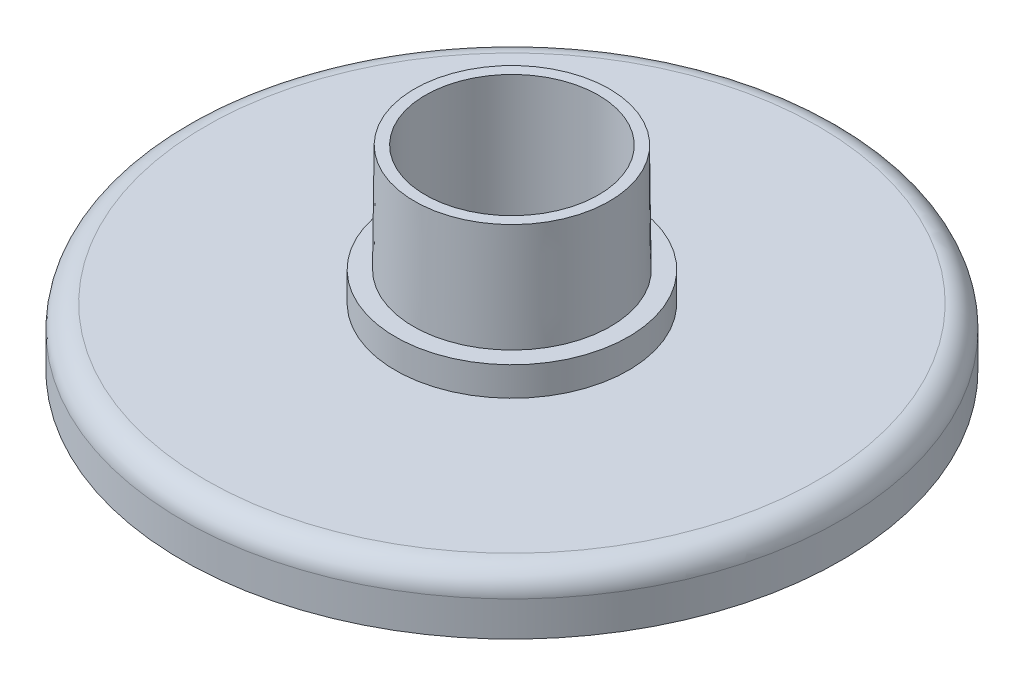
from build123d import *


with BuildPart() as part:
    # Sketch1 → Revolve1 (revolve)
    with BuildSketch(Plane(origin=(0, 0, 0), x_dir=(0, 0, -1), z_dir=(1, 0, 0)), mode=Mode.PRIVATE) as revolve1_sk:
        with BuildLine():
            Line((-7.46, 0), (-28.415, 0))
            Line((-28.415, 0), (-28.415, 3))
            ThreePointArc((-28.415, 3), (-27.829213562, 4.414213562), (-26.415, 5))
            Line((-26.415, 5), (-10.05, 5))
            Line((-10.05, 5), (-10.05, 7.5))
            Line((-10.05, 7.5), (-8.5, 7.5))
            Line((-8.5, 7.5), (-8.4, 16.8))
            Line((-8.4, 16.8), (-7.46, 16.8))
            Line((-7.46, 16.8), (-7.46, 0))
        make_face()
    revolve(revolve1_sk.sketch.rotate(Axis((0, 0, 0), (0, 1, 0)), 180), axis=Axis((0, 0, 0), (0, 1, 0)))


solid = part.part
